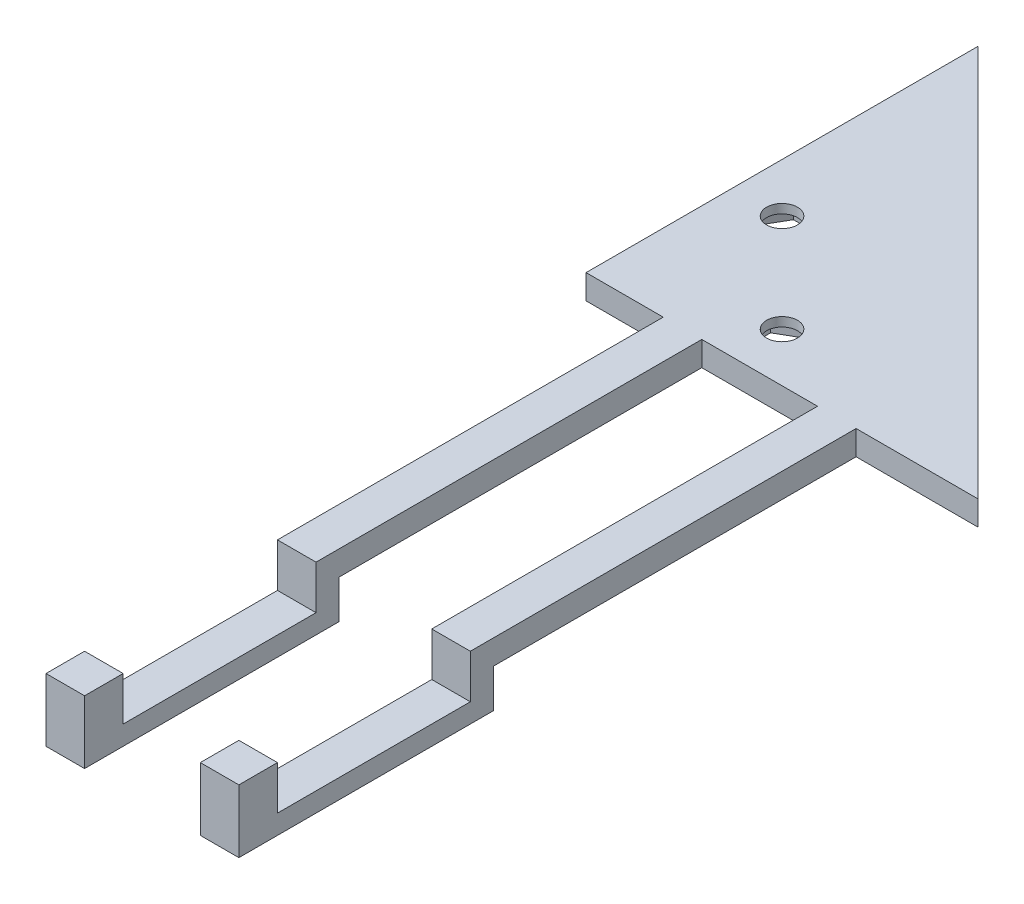
from build123d import *

# Parameters (mm, degrees)
BOSS_EXTRUDE1_DEPTH = 3.175
SKETCH2_R           = 2
CUT_EXTRUDE1_DEPTH  = 72.912172996
CUT_EXTRUDE2_START  = -3.175
CUT_EXTRUDE2_DEPTH  = 2
BOSS_EXTRUDE2_START = 10
BOSS_EXTRUDE2_DEPTH = 5
BOSS_EXTRUDE3_START = 30
BOSS_EXTRUDE3_DEPTH = 5


with BuildPart() as part:
    # Sketch1 → Boss-Extrude1 (new body)
    with BuildSketch(Plane(origin=(0, 0, 0), x_dir=(1, 0, 0), z_dir=(0, 1, 0))):
        Polygon((0, 0), (50.8, 0), (0, 50.8), align=None)
    extrude(amount=BOSS_EXTRUDE1_DEPTH)

    # Sketch2 → Cut-Extrude1 (cut, through all)
    with BuildSketch(Plane(origin=(0, 3.175, 0), x_dir=(1, 0, 0), z_dir=(0, 1, 0))):
        with Locations(Location((19.05, 6.35, 0), (0, 0, 270))):
            Circle(SKETCH2_R)
        with Locations(Location((6.35, 19.05, 0), (0, 0, 90))):
            Circle(SKETCH2_R)
    extrude(amount=-CUT_EXTRUDE1_DEPTH, mode=Mode.SUBTRACT)

    # Sketch3 → Cut-Extrude2 (cut)
    with BuildSketch(Plane(origin=(0, 3.175, 0), x_dir=(1, 0, 0), z_dir=(0, 1, 0)).offset(CUT_EXTRUDE2_START)):
        Polygon((8.370723055, 15.550005), (10.391446111, 19.05), (8.370723055, 22.549995), (4.329276945, 22.549995), (2.308553889, 19.05), (4.329276945, 15.550005), align=None)
        Polygon((22.549995, 4.329276945), (19.05, 2.308553889), (15.550005, 4.329276945), (15.550005, 8.370723055), (19.05, 10.391446111), (22.549995, 8.370723055), align=None)
    extrude(amount=CUT_EXTRUDE2_DEPTH, mode=Mode.SUBTRACT)

    # Sketch5 → Boss-Extrude2 (add)
    with BuildSketch(Plane(origin=(0, 0, 0), x_dir=(0, 0, -1), z_dir=(1, 0, 0)).offset(BOSS_EXTRUDE2_START)):
        Polygon((0, 0), (0, 3.175), (-50, 3.175), (-50, -2.5), (-75, -2.5), (-75, 3.175), (-80, 3.175), (-80, -5), (-47, -5), (-47, 0), align=None)
    extrude(amount=BOSS_EXTRUDE2_DEPTH)

    # Sketch5<3> → Boss-Extrude3 (add)
    with BuildSketch(Plane(origin=(0, 0, 0), x_dir=(0, 0, -1), z_dir=(1, 0, 0)).offset(BOSS_EXTRUDE3_START)):
        Polygon((0, 0), (0, 3.175), (-50, 3.175), (-50, -2.5), (-75, -2.5), (-75, 3.175), (-80, 3.175), (-80, -5), (-47, -5), (-47, 0), align=None)
    extrude(amount=BOSS_EXTRUDE3_DEPTH)


solid = part.part
